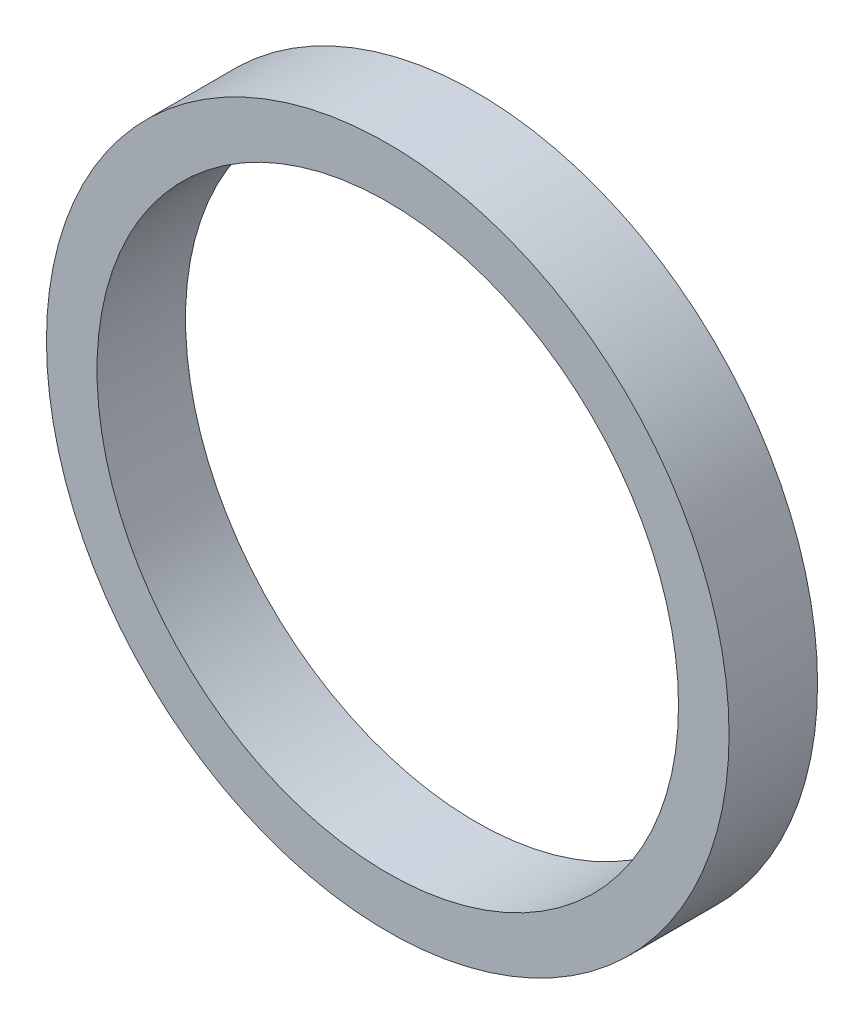
from build123d import *

# Parameters (mm, degrees)
ESQUISSE1_R   = 27
ESQUISSE1_R_2 = 23
BASE_DEPTH    = 7


with BuildPart() as part:
    # Esquisse1 → BASE (new body)
    with BuildSketch(Plane.XY):
        Circle(ESQUISSE1_R)
        Circle(ESQUISSE1_R_2, mode=Mode.SUBTRACT)
    extrude(amount=BASE_DEPTH)


solid = part.part
